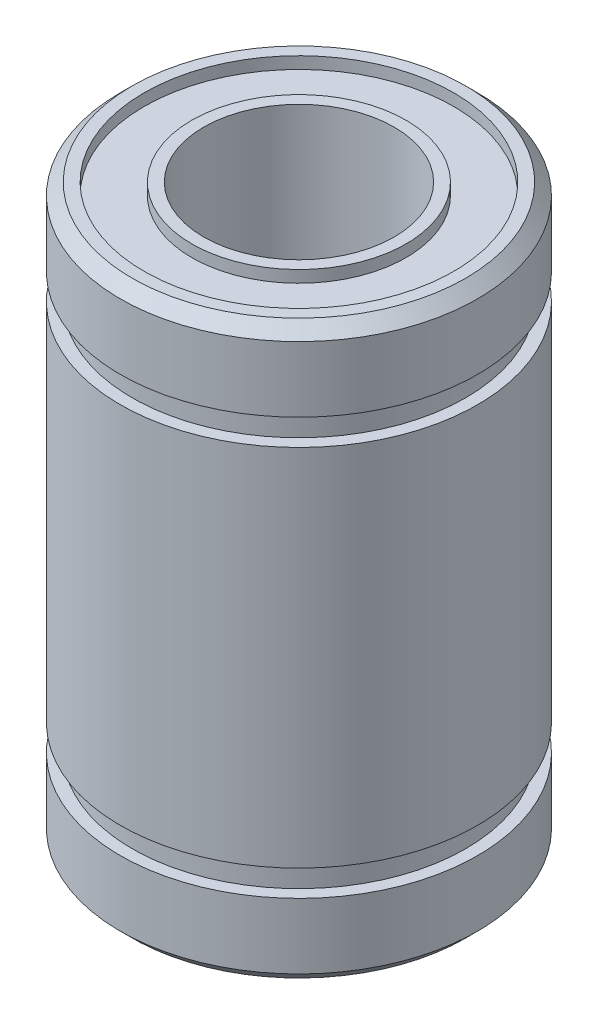
from build123d import *

# Parameters (mm, degrees)
SKETCH2_R          = 6.5
SKETCH2_R_2        = 4.5
CUT_EXTRUDE1_DEPTH = 0.5


with BuildPart() as part:
    # Sketch1 → Revolve1 (revolve)
    with BuildSketch(Plane.XY, mode=Mode.PRIVATE) as revolve1_sk:
        Polygon((4, -12), (4, 12), (7, 12), (7.5, 11.5), (7.5, 8.75), (7, 8.75), (7, 7.65), (7.5, 7.65), (7.5, -7.65), (7, -7.65), (7, -8.75), (7.5, -8.75), (7.5, -11.5), (7, -12), align=None)
    revolve(revolve1_sk.sketch.rotate(Axis((0, 12, 0), (0, -1, 0)), 180), axis=Axis((0, 12, 0), (0, -1, 0)))

    # Sketch2 → Cut-Extrude1 (cut)
    with BuildSketch(Plane(origin=(0, 12, 0), x_dir=(1, 0, 0), z_dir=(0, 1, 0))):
        with Locations(Location((0, 0, 0), (0, 0, 180))):
            Circle(SKETCH2_R)
        with Locations(Location((0, 0, 0), (0, 0, 180))):
            Circle(SKETCH2_R_2, mode=Mode.SUBTRACT)
    cut_extrude1 = extrude(amount=-CUT_EXTRUDE1_DEPTH, mode=Mode.SUBTRACT)

    # Mirror1: Cut-Extrude1 across plane
    add(cut_extrude1.mirror(Plane.ZX), mode=Mode.SUBTRACT)


solid = part.part
